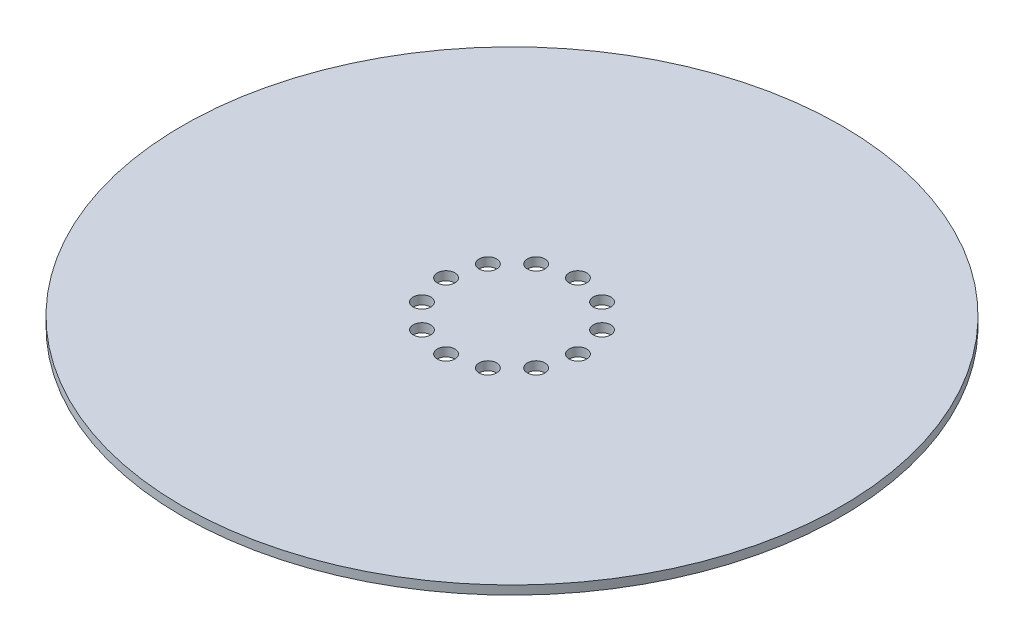
from build123d import *

# Parameters (mm, degrees)
SKETCH1_R           = 300
BOSS_EXTRUDE1_DEPTH = 8
SKETCH2_R           = 8
CUT_EXTRUDE1_DEPTH  = 425.339486732


with BuildPart() as part:
    # Sketch1 → Boss-Extrude1 (new body)
    with BuildSketch(Plane(origin=(0, 0, 0), x_dir=(1, 0, 0), z_dir=(0, 1, 0))):
        with Locations(Location((0, 0, 0), (0, 0, 270))):
            Circle(SKETCH1_R)
    extrude(amount=BOSS_EXTRUDE1_DEPTH)

    # Sketch2 → Cut-Extrude1 (cut, through all)
    with BuildSketch(Plane.XZ):
        with Locations(Location((0, 60, 0), (0, 0, 270))):
            Circle(SKETCH2_R)
        with Locations(Location((30, 51.961524227, 0), (0, 0, 270))):
            Circle(SKETCH2_R)
        with Locations(Location((51.961524227, 30, 0), (0, 0, 270))):
            Circle(SKETCH2_R)
        with Locations(Location((60, 0, 0), (0, 0, 270))):
            Circle(SKETCH2_R)
        with Locations(Location((51.961524227, -30, 0), (0, 0, 270))):
            Circle(SKETCH2_R)
        with Locations(Location((30, -51.961524227, 0), (0, 0, 270))):
            Circle(SKETCH2_R)
        with Locations(Location((0, -60, 0), (0, 0, 270))):
            Circle(SKETCH2_R)
        with Locations(Location((-30, -51.961524227, 0), (0, 0, 270))):
            Circle(SKETCH2_R)
        with Locations(Location((-51.961524227, -30, 0), (0, 0, 270))):
            Circle(SKETCH2_R)
        with Locations(Location((-60, 0, 0), (0, 0, 270))):
            Circle(SKETCH2_R)
        with Locations(Location((-51.961524227, 30, 0), (0, 0, 270))):
            Circle(SKETCH2_R)
        with Locations(Location((-30, 51.961524227, 0), (0, 0, 270))):
            Circle(SKETCH2_R)
    extrude(amount=-CUT_EXTRUDE1_DEPTH, mode=Mode.SUBTRACT)


solid = part.part
